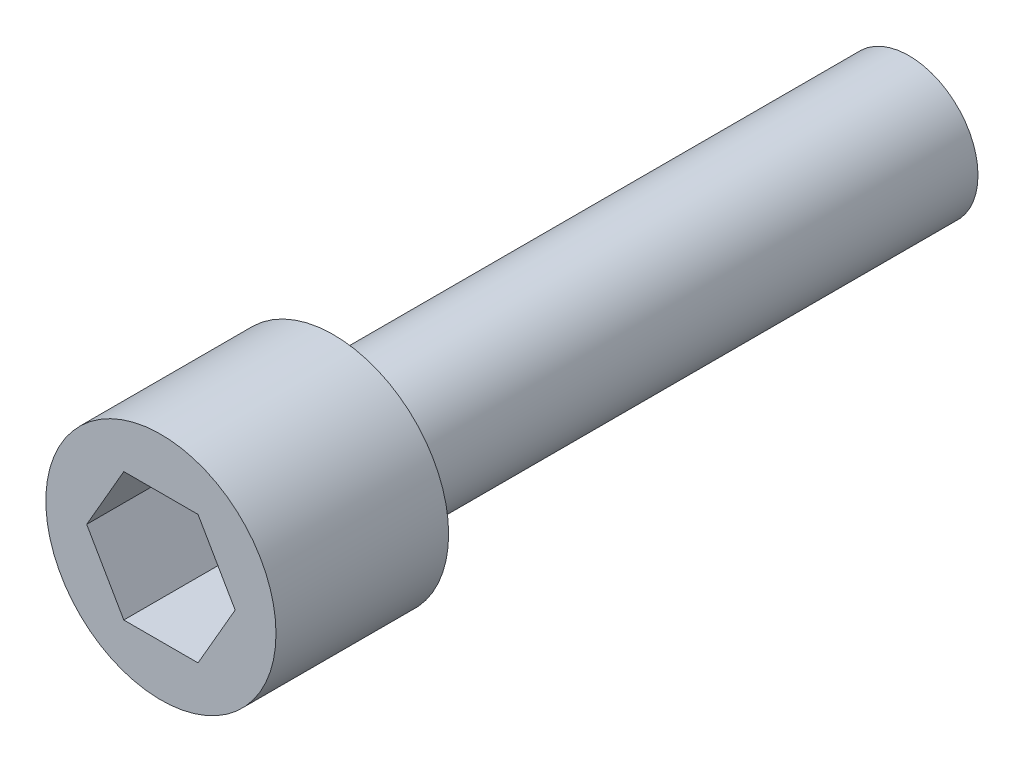
from build123d import *

# Parameters (mm, degrees)
SKETCH1_R           = 1.2
BOSS_EXTRUDE1_DEPTH = 10
SKETCH2_R           = 2
BOSS_EXTRUDE2_DEPTH = 3
CUT_EXTRUDE1_DEPTH  = 2


with BuildPart() as part:
    # Sketch1 → Boss-Extrude1 (new body)
    with BuildSketch(Plane.XY):
        with Locations((-15, 15)):
            Circle(SKETCH1_R)
    extrude(amount=-BOSS_EXTRUDE1_DEPTH)

    # Sketch2 → Boss-Extrude2 (add)
    with BuildSketch(Plane.XY):
        with Locations((-15, 15)):
            Circle(SKETCH2_R)
    extrude(amount=BOSS_EXTRUDE2_DEPTH)

    # Sketch3 → Cut-Extrude1 (cut)
    with BuildSketch(Plane.XY.offset(3)):
        Polygon((-13.709947687, 15), (-14.354973843, 16.117218076), (-15.645026157, 16.117218076), (-16.290052313, 15), (-15.645026157, 13.882781924), (-14.354973843, 13.882781924), align=None)
    extrude(amount=-CUT_EXTRUDE1_DEPTH, mode=Mode.SUBTRACT)


solid = part.part
